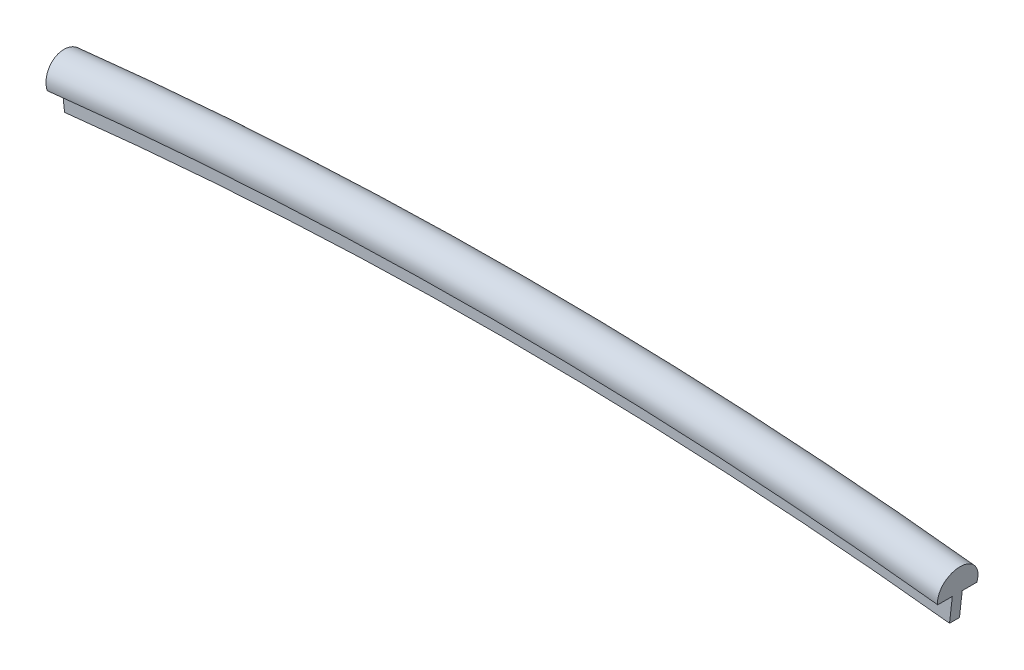
from build123d import *

# Parameters (mm, degrees)
REVOLVE1_ANGLE           = 6.403930703
REVOLVE1_OTHER_WAY_ANGLE = 6.403930703


with BuildPart() as part:
    # Sketch2 → Revolve1 (revolve)
    with BuildSketch(Plane(origin=(0, 0, 0), x_dir=(0, 0, -1), z_dir=(1, 0, 0))):
        with BuildLine():
            Line((0, 239.8), (0.3, 239.8))
            Line((0.3, 239.8), (0.3, 241.3))
            Line((0.3, 241.3), (1.18, 241.3))
            ThreePointArc((1.18, 241.3), (0, 242.800182019), (-1.18, 241.3))
            Line((-1.18, 241.3), (-0.3, 241.3))
            Line((-0.3, 241.3), (-0.3, 239.8))
            Line((-0.3, 239.8), (0, 239.8))
        make_face()
    revolve(axis=Axis((0, 0, 70.597641597), (0, 0, -1)), revolution_arc=REVOLVE1_ANGLE)

    # Sketch2 → Revolve1 other way (revolve)
    with BuildSketch(Plane(origin=(0, 0, 0), x_dir=(0, 0, -1), z_dir=(1, 0, 0))):
        with BuildLine():
            Line((0, 239.8), (0.3, 239.8))
            Line((0.3, 239.8), (0.3, 241.3))
            Line((0.3, 241.3), (1.18, 241.3))
            ThreePointArc((1.18, 241.3), (0, 242.800182019), (-1.18, 241.3))
            Line((-1.18, 241.3), (-0.3, 241.3))
            Line((-0.3, 241.3), (-0.3, 239.8))
            Line((-0.3, 239.8), (0, 239.8))
        make_face()
    revolve(axis=Axis((0, 0, 70.597641597), (0, 0, 1)), revolution_arc=REVOLVE1_OTHER_WAY_ANGLE)


solid = part.part
